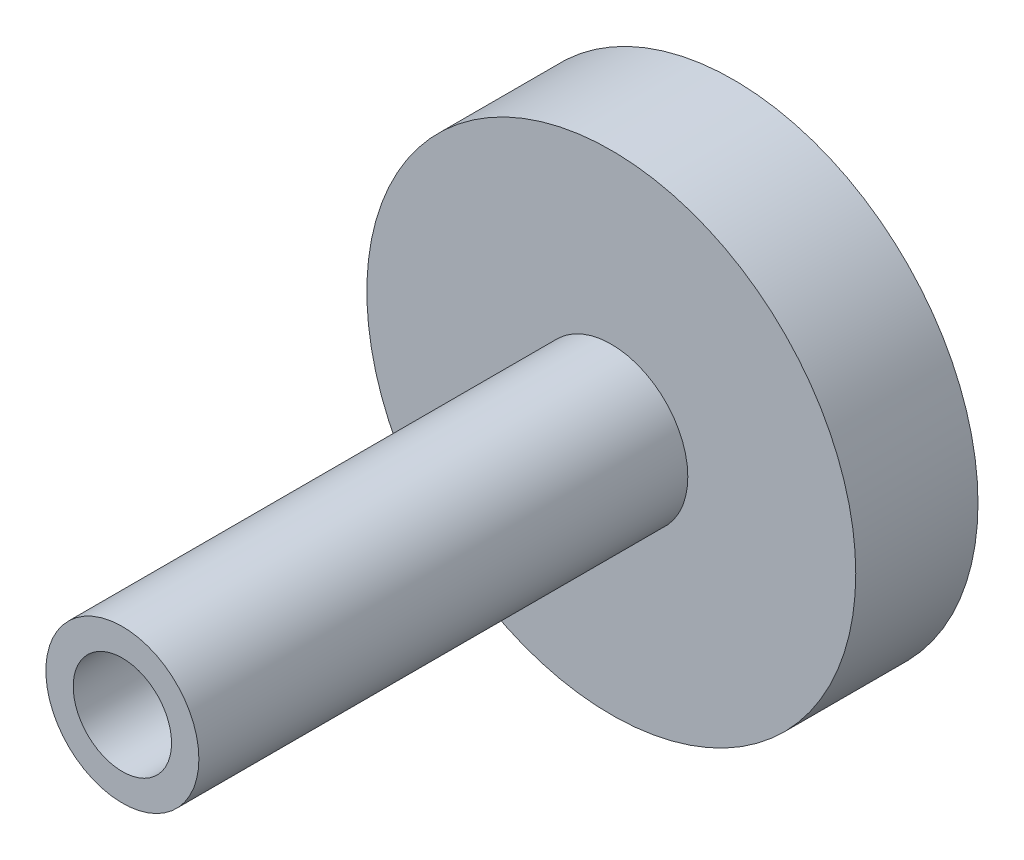
from build123d import *

# Parameters (mm, degrees)
SKETCH1_R           = 12.7
SKETCH1_R_2         = 2.555
BOSS_EXTRUDE1_DEPTH = 31.75
CUT_EXTRUDE1_START  = -25.4
SKETCH2_R           = 12.7
SKETCH2_R_2         = 3.9751
CUT_EXTRUDE1_DEPTH  = 25.4


with BuildPart() as part:
    # Sketch1 → Boss-Extrude1 (new body)
    with BuildSketch(Plane.XY):
        Circle(SKETCH1_R)
        Circle(SKETCH1_R_2, mode=Mode.SUBTRACT)
    extrude(amount=BOSS_EXTRUDE1_DEPTH)

    # Sketch2 → Cut-Extrude1 (cut)
    with BuildSketch(Plane.XY.offset(31.75).offset(CUT_EXTRUDE1_START)):
        Circle(SKETCH2_R)
        Circle(SKETCH2_R_2, mode=Mode.SUBTRACT)
    extrude(amount=CUT_EXTRUDE1_DEPTH, mode=Mode.SUBTRACT)


solid = part.part
